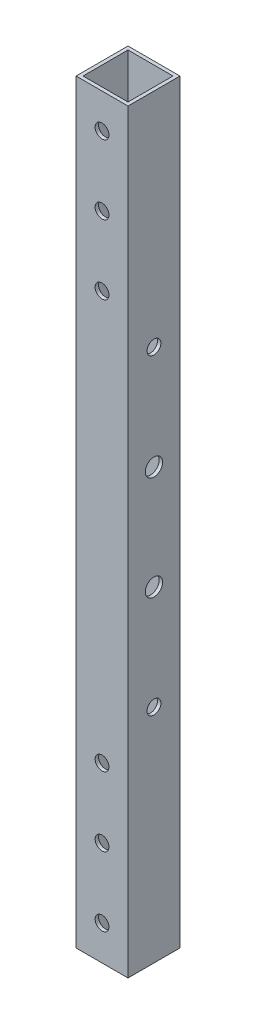
from build123d import *

# Parameters (mm, degrees)
SKETCH_1_W          = 15
SKETCH_1_H          = 15
SKETCH_1_W_2        = 13
SKETCH_1_H_2        = 13
EXTRUDE_1_DEPTH     = 218
SKETCH_3_R          = 2
CUT_EXTRUDE_2_DEPTH = 219.644117232
SKETCH_5_R          = 2.5
SKETCH_5_R_2        = 2
CUT_EXTRUDE_4_DEPTH = 219.644117232


with BuildPart() as part:
    # 草图1 → 凸台-拉伸1 (new body)
    with BuildSketch(Plane(origin=(0, 0, 0), x_dir=(1, 0, 0), z_dir=(0, 1, 0))):
        Rectangle(SKETCH_1_W, SKETCH_1_H)
        Rectangle(SKETCH_1_W_2, SKETCH_1_H_2, mode=Mode.SUBTRACT)
    extrude(amount=EXTRUDE_1_DEPTH)

    # 草图3 → 切除-拉伸2 (cut, through all)
    with BuildSketch(Plane.XY.offset(7.5)):
        with Locations((0, 208)):
            Circle(SKETCH_3_R)
        with Locations((0, 188)):
            Circle(SKETCH_3_R)
        with Locations(Location((0, 30, 0), (0, 0, 180))):
            Circle(SKETCH_3_R)
        with Locations(Location((0, 10, 0), (0, 0, 180))):
            Circle(SKETCH_3_R)
        with Locations((0, 168)):
            Circle(SKETCH_3_R)
        with Locations(Location((0, 50, 0), (0, 0, 180))):
            Circle(SKETCH_3_R)
    extrude(amount=-CUT_EXTRUDE_2_DEPTH, mode=Mode.SUBTRACT)

    # 草图5 → 切除-拉伸4 (cut, through all)
    with BuildSketch(Plane(origin=(7.5, 0, 0), x_dir=(0, 0, -1), z_dir=(1, 0, 0))):
        with Locations((0, 124)):
            Circle(SKETCH_5_R)
        with Locations((0, 94)):
            Circle(SKETCH_5_R)
        with Locations((0, 154)):
            Circle(SKETCH_5_R_2)
        with Locations((0, 64)):
            Circle(SKETCH_5_R_2)
    extrude(amount=-CUT_EXTRUDE_4_DEPTH, mode=Mode.SUBTRACT)


solid = part.part
